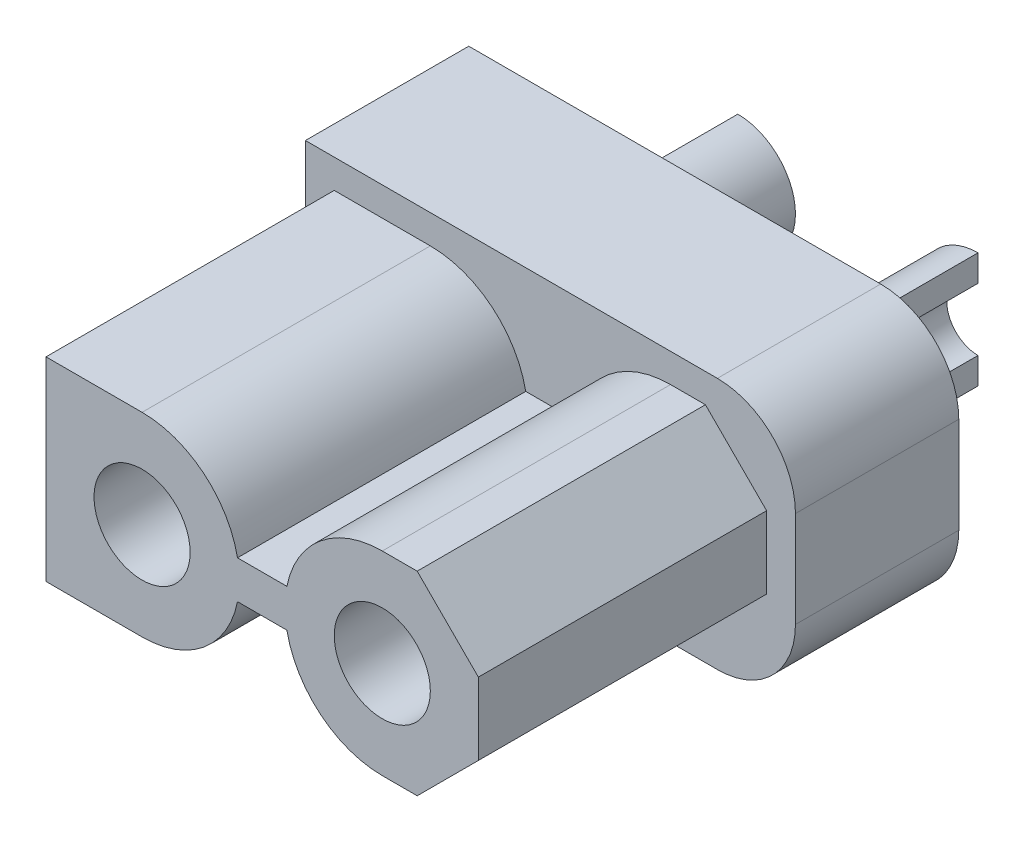
from build123d import *

# Parameters (mm, degrees)
SKETCH1_R           = 1
BOSS_EXTRUDE1_DEPTH = 3.4
BOSS_EXTRUDE3_DEPTH = 8.4
SKETCH5_R           = 1.2
BOSS_EXTRUDE6_DEPTH = 12.4
SKETCH6_R           = 0.65
CUT_EXTRUDE2_DEPTH  = 3
CUT_EXTRUDE3_START  = -2.34
CUT_EXTRUDE3_DEPTH  = 2.34
SKETCH8_R           = 1
CUT_EXTRUDE4_DEPTH  = 6


with BuildPart() as part:
    # Sketch1 → Boss-Extrude1 (new body)
    # profile 1 of 4: a face of its own
    with BuildSketch(Plane.XY):
        with BuildLine():
            Line((0, -2.625), (0, 2.625))
            Line((0, 2.625), (8.575, 2.625))
            ThreePointArc((8.575, 2.625), (9.724048519, 2.149048519), (10.2, 1))
            Line((10.2, 1), (10.2, -1))
            ThreePointArc((10.2, -1), (9.724048519, -2.149048519), (8.575, -2.625))
            Line((8.575, -2.625), (0, -2.625))
        make_face()
        Polygon((0.5, -2.125), (8.367893219, -2.125), (9.7, -0.792893219), (9.7, 0.792893219), (8.367893219, 2.125), (0.5, 2.125), align=None, mode=Mode.SUBTRACT)
    # profile 2 of 4: a face of its own
    with BuildSketch(Plane.XY):
        Polygon((0.5, -2.125), (0.5, 2.125), (8.367893219, 2.125), (9.7, 0.792893219), (9.7, -0.792893219), (8.367893219, -2.125), align=None)
        with Locations((2.6, 0)):
            Circle(SKETCH1_R, mode=Mode.SUBTRACT)
        with Locations((7.6, 0)):
            Circle(SKETCH1_R, mode=Mode.SUBTRACT)
    # profile 3 of 4: a face of its own
    with BuildSketch(Plane.XY):
        with Locations((7.6, 0)):
            Circle(SKETCH1_R)
    # profile 4 of 4: a face of its own
    with BuildSketch(Plane.XY):
        with Locations((2.6, 0)):
            Circle(SKETCH1_R)
    extrude(amount=BOSS_EXTRUDE1_DEPTH)

    # Sketch3 → Boss-Extrude3 (add)
    with BuildSketch(Plane(origin=(0, 0, 1), x_dir=(-1, 0, 0), z_dir=(0, 0, -1))):
        with BuildLine():
            Line((-5.613898291, -0.395), (-4.586101709, -0.395))
            ThreePointArc((-4.586101709, -0.395), (-3.884669218, -1.565327442), (-2.6, -2.025))
            Line((-2.6, -2.025), (-0.6, -2.025))
            Line((-0.6, -2.025), (-0.6, 2.025))
            Line((-0.6, 2.025), (-2.6, 2.025))
            ThreePointArc((-2.6, 2.025), (-3.884669218, 1.565327442), (-4.586101709, 0.395))
            Line((-4.586101709, 0.395), (-5.613898291, 0.395))
            ThreePointArc((-5.613898291, 0.395), (-6.315330782, 1.565327442), (-7.6, 2.025))
            Line((-7.6, 2.025), (-8.326471863, 2.025))
            Line((-8.326471863, 2.025), (-9.6, 0.751471863))
            Line((-9.6, 0.751471863), (-9.6, -0.751471863))
            Line((-9.6, -0.751471863), (-8.326471863, -2.025))
            Line((-8.326471863, -2.025), (-7.6, -2.025))
            ThreePointArc((-7.6, -2.025), (-6.315330782, -1.565327442), (-5.613898291, -0.395))
        make_face()
    extrude(amount=-BOSS_EXTRUDE3_DEPTH)

    # Sketch5 → Boss-Extrude6 (add)
    with BuildSketch(Plane.XY.offset(9.4)):
        with Locations((7.6, 0)):
            Circle(SKETCH5_R)
        with Locations((2.6, 0)):
            Circle(SKETCH5_R)
    extrude(amount=-BOSS_EXTRUDE6_DEPTH)

    # Sketch6 → Cut-Extrude2 (cut)
    with BuildSketch(Plane(origin=(0, 0, -3), x_dir=(-1, 0, 0), z_dir=(0, 0, -1))):
        with Locations((-7.6, 0)):
            Circle(SKETCH6_R)
        with Locations((-2.6, 0)):
            Circle(SKETCH6_R)
    extrude(amount=-CUT_EXTRUDE2_DEPTH, mode=Mode.SUBTRACT)

    # Sketch7 → Cut-Extrude3 (cut)
    with BuildSketch(Plane(origin=(0, 0, -3), x_dir=(-1, 0, 0), z_dir=(0, 0, -1)).offset(CUT_EXTRUDE3_START)):
        with BuildLine():
            Line((-2.6, -0.65), (-2.6, -1.2))
            ThreePointArc((-2.6, -1.2), (-1.751471863, -0.848528137), (-1.4, 0))
            ThreePointArc((-1.4, 0), (-1.751471863, 0.848528137), (-2.6, 1.2))
            Line((-2.6, 1.2), (-2.6, 0.65))
            ThreePointArc((-2.6, 0.65), (-2.140380592, 0.459619408), (-1.95, 0))
            ThreePointArc((-1.95, 0), (-2.140380592, -0.459619408), (-2.6, -0.65))
        make_face()
        with BuildLine():
            ThreePointArc((-7.6, 1.2), (-8.8, 0), (-7.6, -1.2))
            Line((-7.6, -1.2), (-7.6, 1.2))
        make_face()
    extrude(amount=CUT_EXTRUDE3_DEPTH, mode=Mode.SUBTRACT)

    # Sketch8 → Cut-Extrude4 (cut)
    with BuildSketch(Plane.XY.offset(9.4)):
        with Locations((7.6, 0)):
            Circle(SKETCH8_R)
        with Locations((2.6, 0)):
            Circle(SKETCH8_R)
    extrude(amount=-CUT_EXTRUDE4_DEPTH, mode=Mode.SUBTRACT)


solid = part.part
